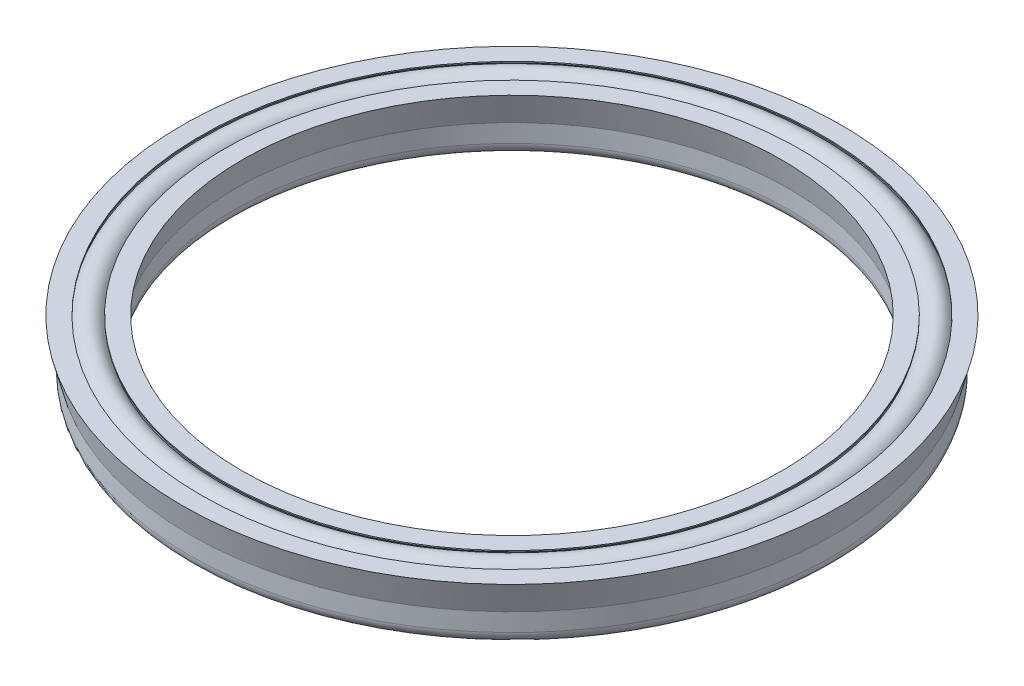
from build123d import *

# Parameters (mm, degrees)
SKETCH1_R = 1.468435222


with BuildPart() as part:
    # Sketch1 → Revolve1 (revolve)
    with BuildSketch(Plane.XY, mode=Mode.PRIVATE) as revolve1_sk:
        with Locations((-31.749995075, -1.136070965)):
            Circle(SKETCH1_R)
        with BuildLine():
            Line((-32.861243351, -6.248390307), (-30.638746798, -6.248390307))
            ThreePointArc((-30.638746798, -6.248390307), (-29.740722579, -5.876416496), (-29.368748769, -4.978392277))
            Line((-29.368748769, -4.978392277), (-29.368748769, -3.073395232))
            Line((-29.368748769, -3.073395232), (-28.575, 0))
            Line((-28.575, 0), (-30.528843123, 0))
            Line((-30.528843123, 0), (-30.528843123, -0.121705971))
            ThreePointArc((-30.528843123, -0.121705971), (-31.749995075, -2.723568502), (-32.971147026, -0.121705971))
            Line((-32.971147026, -0.121705971), (-32.971147026, 0))
            Line((-32.971147026, 0), (-34.924990149, 0))
            Line((-34.924990149, 0), (-34.13124138, -3.073395232))
            Line((-34.13124138, -3.073395232), (-34.13124138, -4.978392277))
            ThreePointArc((-34.13124138, -4.978392277), (-33.75926757, -5.876416496), (-32.861243351, -6.248390307))
        make_face()
    revolve(revolve1_sk.sketch.rotate(Axis((0, 0, 0), (0, -1, 0)), 270), axis=Axis((0, 0, 0), (0, -1, 0)))


solid = part.part
